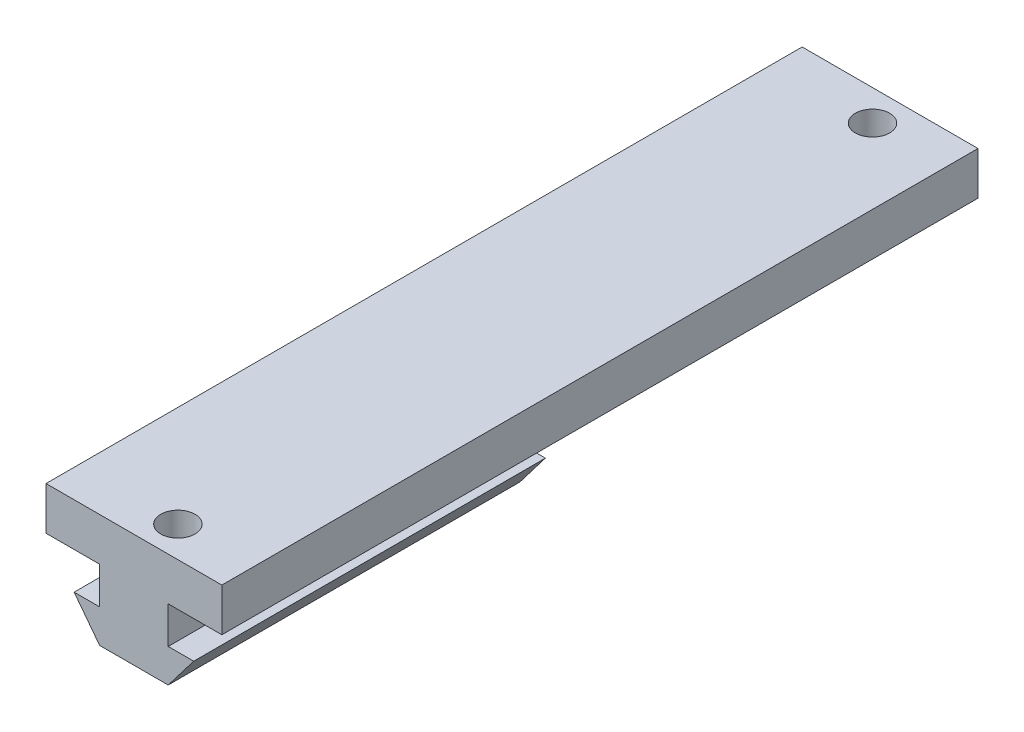
from build123d import *

# Parameters (mm, degrees)
SKETCH1_W           = 20
SKETCH1_H           = 86
BOSS_EXTRUDE1_DEPTH = 4.9
BOSS_EXTRUDE4_DEPTH = 40
SKETCH2_R           = 1.95
CUT_EXTRUDE1_DEPTH  = 6


with BuildPart() as part:
    # Sketch1 → Boss-Extrude1 (new body)
    with BuildSketch(Plane(origin=(0, 0, 0), x_dir=(1, 0, 0), z_dir=(0, 1, 0))):
        Rectangle(SKETCH1_W, SKETCH1_H)
    extrude(amount=BOSS_EXTRUDE1_DEPTH)

    # Sketch4 → Boss-Extrude4 (add)
    with BuildSketch(Plane.XY.offset(43)):
        Polygon((-3.9, 0), (-3.9, -4.2), (-6.8, -4.2), (-3.9, -8), (3.9, -8), (6.8, -4.2), (3.9, -4.2), (3.9, 0), align=None)
    extrude(amount=-BOSS_EXTRUDE4_DEPTH)

    # Sketch2 → Cut-Extrude1 (cut)
    with BuildSketch(Plane(origin=(0, 4.9, 0), x_dir=(1, 0, 0), z_dir=(0, 1, 0))):
        with Locations(Location((1.5, -39.5, 0), (0, 0, 270))):
            Circle(SKETCH2_R)
        with Locations(Location((1.5, 39.5, 0), (0, 0, 270))):
            Circle(SKETCH2_R)
    extrude(amount=-CUT_EXTRUDE1_DEPTH, mode=Mode.SUBTRACT)


solid = part.part
